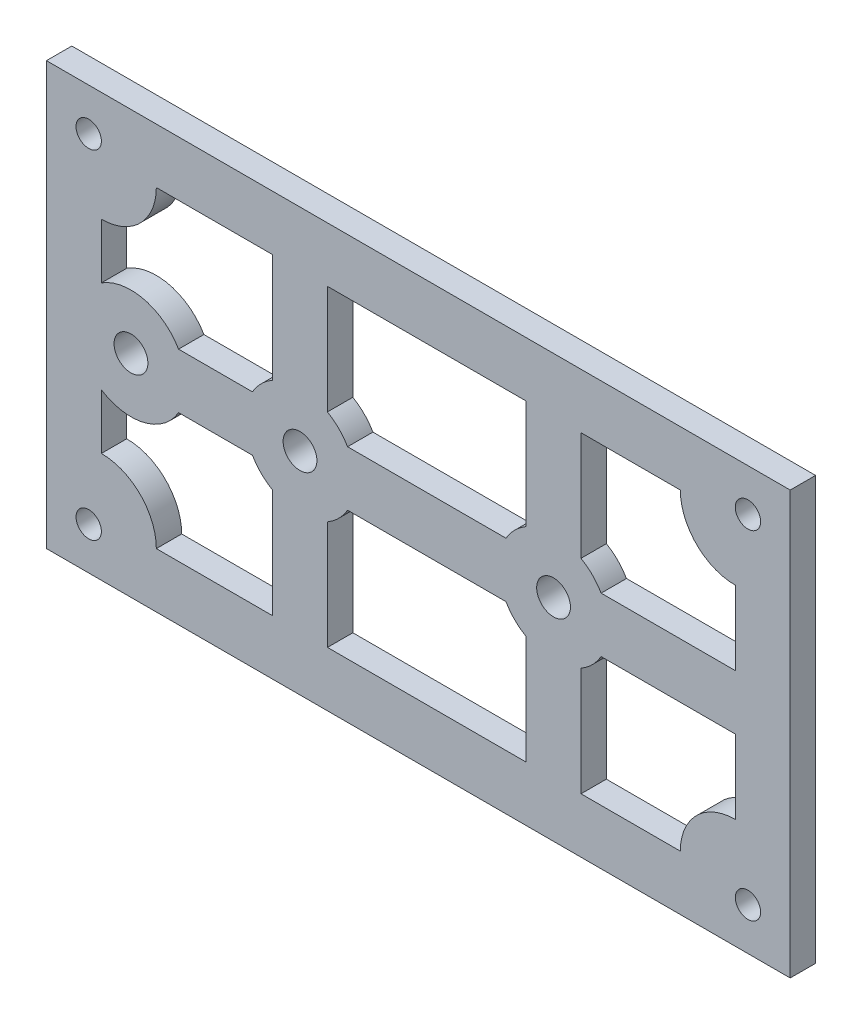
from build123d import *

# Parameters (mm, degrees)
SKETCH1_W            = 88
SKETCH1_H            = 50
BOSS_EXTRUDE1_DEPTH  = 3
SKETCH2_R            = 2
CUT_EXTRUDE1_DEPTH   = 51.695167423
SKETCH3_R            = 1.5
CUT_EXTRUDE2_DEPTH   = 51.695167423
LPATTERN1_COUNT      = 2
LPATTERN1_PITCH      = 78
LPATTERN1_COUNT_DIR2 = 2
LPATTERN1_PITCH_DIR2 = 40
CUT_EXTRUDE3_DEPTH   = 51.695167423


with BuildPart() as part:
    # Sketch1 → Boss-Extrude1 (new body)
    with BuildSketch(Plane.XY):
        Rectangle(SKETCH1_W, SKETCH1_H)
    extrude(amount=BOSS_EXTRUDE1_DEPTH)

    # Sketch2 → Cut-Extrude1 (cut, through all)
    with BuildSketch(Plane.XY.offset(3)):
        with Locations((-34, 0)):
            Circle(SKETCH2_R)
        with Locations((-14, 0)):
            Circle(SKETCH2_R)
        with Locations((16, 0)):
            Circle(SKETCH2_R)
    extrude(amount=-CUT_EXTRUDE1_DEPTH, mode=Mode.SUBTRACT)

    # Sketch3 → Cut-Extrude2 (cut, through all)
    with BuildSketch(Plane.XY.offset(3)):
        with Locations((-39, 20)):
            Circle(SKETCH3_R)
    cut_extrude2 = extrude(amount=-CUT_EXTRUDE2_DEPTH, mode=Mode.SUBTRACT)

    # LPattern1: Cut-Extrude2 2 × 2
    with Locations(*[(i * LPATTERN1_PITCH, -j * LPATTERN1_PITCH_DIR2, 0) for i in range(LPATTERN1_COUNT) for j in range(LPATTERN1_COUNT_DIR2) if (i, j) != (0, 0)]):
        add(cut_extrude2, mode=Mode.SUBTRACT)

    # Sketch4 → Cut-Extrude3 (cut, through all)
    with BuildSketch(Plane.XY.offset(3)):
        with BuildLine():
            Line((37.5, 3.25), (37.5, 12))
            ThreePointArc((37.5, 12), (32.903805922, 13.903805922), (31, 18.5))
            Line((31, 18.5), (19.25, 18.5))
            Line((19.25, 18.5), (19.25, 5.629165125))
            ThreePointArc((19.25, 5.629165125), (20.596194078, 4.596194078), (21.629165125, 3.25))
            Line((21.629165125, 3.25), (37.5, 3.25))
        make_face()
        with BuildLine():
            Line((-28.370834875, 3.25), (-19.629165125, 3.25))
            ThreePointArc((-19.629165125, 3.25), (-18.596194078, 4.596194078), (-17.25, 5.629165125))
            Line((-17.25, 5.629165125), (-17.25, 18.5))
            Line((-17.25, 18.5), (-31, 18.5))
            ThreePointArc((-31, 18.5), (-32.903805922, 13.903805922), (-37.5, 12))
            Line((-37.5, 12), (-37.5, 5.477225575))
            ThreePointArc((-37.5, 5.477225575), (-32.459393148, 6.314786657), (-28.370834875, 3.25))
        make_face()
        with BuildLine():
            Line((-8.370834875, 3.25), (10.370834875, 3.25))
            ThreePointArc((10.370834875, 3.25), (11.403805922, 4.596194078), (12.75, 5.629165125))
            Line((12.75, 5.629165125), (12.75, 18.5))
            Line((12.75, 18.5), (-10.75, 18.5))
            Line((-10.75, 18.5), (-10.75, 5.629165125))
            ThreePointArc((-10.75, 5.629165125), (-9.403805922, 4.596194078), (-8.370834875, 3.25))
        make_face()
        with BuildLine():
            Line((-28.370834875, -3.25), (-19.629165125, -3.25))
            ThreePointArc((-19.629165125, -3.25), (-18.596194078, -4.596194078), (-17.25, -5.629165125))
            Line((-17.25, -5.629165125), (-17.25, -18.5))
            Line((-17.25, -18.5), (-31, -18.5))
            ThreePointArc((-31, -18.5), (-32.903805922, -13.903805922), (-37.5, -12))
            Line((-37.5, -12), (-37.5, -5.477225575))
            ThreePointArc((-37.5, -5.477225575), (-32.459393148, -6.314786657), (-28.370834875, -3.25))
        make_face()
        with BuildLine():
            Line((37.5, -12), (37.5, -3.25))
            Line((37.5, -3.25), (21.629165125, -3.25))
            ThreePointArc((21.629165125, -3.25), (20.596194078, -4.596194078), (19.25, -5.629165125))
            Line((19.25, -5.629165125), (19.25, -18.5))
            Line((19.25, -18.5), (31, -18.5))
            ThreePointArc((31, -18.5), (32.903805922, -13.903805922), (37.5, -12))
        make_face()
        with BuildLine():
            Line((-8.370834875, -3.25), (10.370834875, -3.25))
            ThreePointArc((10.370834875, -3.25), (11.403805922, -4.596194078), (12.75, -5.629165125))
            Line((12.75, -5.629165125), (12.75, -18.5))
            Line((12.75, -18.5), (-10.75, -18.5))
            Line((-10.75, -18.5), (-10.75, -5.629165125))
            ThreePointArc((-10.75, -5.629165125), (-9.403805922, -4.596194078), (-8.370834875, -3.25))
        make_face()
    extrude(amount=-CUT_EXTRUDE3_DEPTH, mode=Mode.SUBTRACT)


solid = part.part
